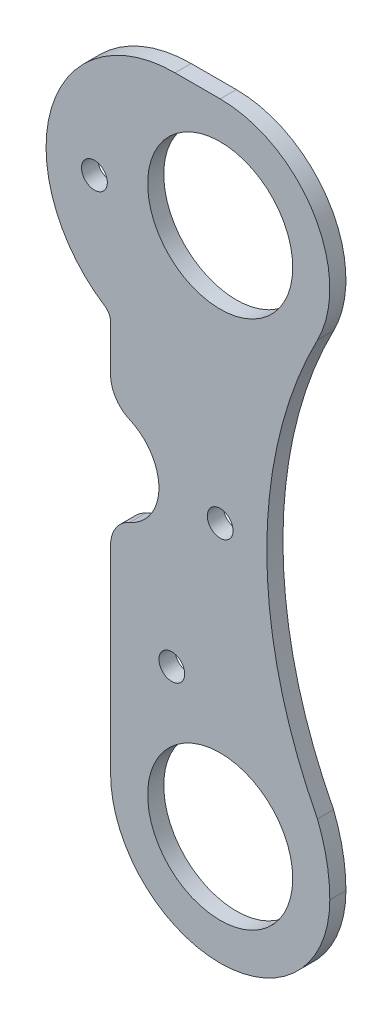
from build123d import *

# Parameters (mm, degrees)
SKETCH1_R            = 14.2875
SKETCH1_R_2          = 2.54
BOSS_EXTRUDE1_DEPTH  = 3.175
CUT_EXTRUDE1_DEPTH   = 162.674043733
FILLET3_R            = 6.35
BOSS_EXTRUDE3_START  = -3.175
SKETCH3_R            = 2.54
BOSS_EXTRUDE3_DEPTH  = 3.175
SKETCH6_R            = 2.54
BOSS_EXTRUDE4_DEPTH  = 3.175
FILLET2_R            = 6.35
CUT_EXTRUDE2_DEPTH   = 168.423732074
CUT_EXTRUDE3_DEPTH   = 168.423732074
CUT_EXTRUDE4_DEPTH   = 168.265702461
BOSS_EXTRUDE8_START  = -3.175
SKETCH15_R           = 2.54
BOSS_EXTRUDE8_DEPTH  = 3.175
FILLET4_R            = 2.54
BOSS_EXTRUDE9_DEPTH  = 3.175
SKETCH17_R           = 14.2875
BOSS_EXTRUDE10_DEPTH = 3.175
CUT_EXTRUDE5_DEPTH   = 131.456264953
SKETCH20_R           = 14.2875
CUT_EXTRUDE6_DEPTH   = 131.456264953
SKETCH21_R           = 2.54
CUT_EXTRUDE7_DEPTH   = 131.456264953


with BuildPart() as part:
    # Sketch1 → Boss-Extrude1 (new body)
    with BuildSketch(Plane.XY):
        with BuildLine():
            Line((-8.89, 25.4), (8.89, 25.4))
            ThreePointArc((8.89, 25.4), (17.870256121, 21.680256121), (21.59, 12.7))
            Line((21.59, 12.7), (21.59, -117.775079775))
            ThreePointArc((21.59, -117.775079775), (21.127743647, -120.388718212), (19.797058824, -122.685251408))
            Line((19.797058824, -122.685251408), (-7.952696208, -155.616779465))
            ThreePointArc((-7.952696208, -155.616779465), (-12.268297602, -157.851943494), (-16.900388255, -156.380852124))
            Line((-16.900388255, -156.380852124), (-32.439211784, -143.287061102))
            ThreePointArc((-32.439211784, -143.287061102), (-34.674375812, -138.971459708), (-33.203284443, -134.339369055))
            Line((-33.203284443, -134.339369055), (-23.382941176, -122.685251408))
            ThreePointArc((-23.382941176, -122.685251408), (-22.052256353, -120.388718212), (-21.59, -117.775079775))
            Line((-21.59, -117.775079775), (-21.59, 12.7))
            ThreePointArc((-21.59, 12.7), (-17.870256121, 21.680256121), (-8.89, 25.4))
        make_face()
        Circle(SKETCH1_R, mode=Mode.SUBTRACT)
        with Locations((0, -101.6)):
            Circle(SKETCH1_R, mode=Mode.SUBTRACT)
        with Locations((-18.532085478, -142.550133084)):
            Circle(SKETCH1_R_2, mode=Mode.SUBTRACT)
        with Locations((0, -50.8)):
            Circle(SKETCH1_R_2, mode=Mode.SUBTRACT)
    extrude(amount=BOSS_EXTRUDE1_DEPTH)

    # Sketch2 → Cut-Extrude1 (cut, through all)
    with BuildSketch(Plane.XY):
        with BuildLine():
            ThreePointArc((19.159083004, -91.647229609), (9.182340769, -50.8), (19.159083004, -9.952770391))
            ThreePointArc((19.159083004, -9.952770391), (20.973467787, -5.122670102), (21.59, 0))
            Line((21.59, 0), (27.94, 0))
            Line((27.94, 0), (27.94, -121.656687185))
            Line((27.94, -121.656687185), (-7.789552878, -164.05809836))
            Line((-7.789552878, -164.05809836), (-17.501317584, -155.874478972))
            Line((-17.501317584, -155.874478972), (16.51, -115.512152961))
            ThreePointArc((16.51, -115.512152961), (20.280273667, -109.005308906), (21.59, -101.6))
            ThreePointArc((21.59, -101.6), (20.973467787, -96.477329898), (19.159083004, -91.647229609))
        make_face()
        with BuildLine():
            Line((-21.59, -41.275), (-21.59, -60.325))
            ThreePointArc((-21.59, -60.325), (-12.065, -50.8), (-21.59, -41.275))
        make_face()
    extrude(amount=CUT_EXTRUDE1_DEPTH, mode=Mode.SUBTRACT)

    # Fillet3
    fillet3_edges = [part.edges().sort_by_distance(p)[0] for p in [
        (-21.59, -41.275, 1.5875),
        (-21.59, -60.325, 1.5875),
    ]]
    fillet(fillet3_edges, radius=FILLET3_R)

    # Sketch3 → Boss-Extrude3 (add)
    with BuildSketch(Plane.XY.offset(3.175).offset(BOSS_EXTRUDE3_START)):
        with BuildLine():
            Line((-27.351416194, -127.394768527), (-36.025496499, -137.688579))
            ThreePointArc((-36.025496499, -137.688579), (-37.217489152, -141.441859142), (-35.4063854, -144.93869507))
            Line((-35.4063854, -144.93869507), (-24.403104784, -154.210610454))
            ThreePointArc((-24.403104784, -154.210610454), (-19.771014132, -155.681701823), (-15.455412737, -153.446537795))
            Line((-15.455412737, -153.446537795), (-7.557639641, -144.073996091))
            Line((-7.557639641, -144.073996091), (-27.351416194, -127.394768527))
        make_face()
        with Locations((-18.532085478, -142.550133084)):
            Circle(SKETCH3_R, mode=Mode.SUBTRACT)
    extrude(amount=BOSS_EXTRUDE3_DEPTH)

    # Sketch6 → Boss-Extrude4 (add)
    with BuildSketch(Plane.XY.offset(3.175)):
        Polygon((-35.4063854, -144.93869507), (-63.620410749, -121.164144113), (-51.344981666, -106.596497054), (-27.065569901, -127.055545526), align=None)
        with Locations((-52.626813855, -117.972130278)):
            Circle(SKETCH6_R, mode=Mode.SUBTRACT)
    extrude(amount=-BOSS_EXTRUDE4_DEPTH)

    # Fillet2
    fillet2_edges = [part.edges().sort_by_distance(p)[0] for p in [
        (-63.620410749, -121.164144113, 1.5875),
        (-51.344981666, -106.596497054, 1.5875),
        (-27.065569901, -127.055545526, 1.5875),
    ]]
    fillet(fillet2_edges, radius=FILLET2_R)

    # Sketch7 → Cut-Extrude2 (cut, through all)
    with BuildSketch(Plane.XY.offset(3.175)):
        with BuildLine():
            Line((-21.59, 0), (-21.59, 31.75))
            Line((-21.59, 31.75), (21.59, 31.75))
            Line((21.59, 31.75), (21.59, 0))
            ThreePointArc((21.59, 0), (0, 21.59), (-21.59, 0))
        make_face()
    extrude(amount=-CUT_EXTRUDE2_DEPTH, mode=Mode.SUBTRACT)

    # Sketch10 → Cut-Extrude3 (cut, through all)
    with BuildSketch(Plane.XY.offset(3.175)):
        with BuildLine():
            Line((-18.151882461, -155.32628042), (-17.361482582, -157.512020269))
            Line((-17.361482582, -157.512020269), (-14.375706423, -156.432313955))
            Line((-14.375706423, -156.432313955), (-15.455412737, -153.446537795))
            ThreePointArc((-15.455412737, -153.446537795), (-16.679911193, -154.563907595), (-18.151882461, -155.32628042))
        make_face()
    extrude(amount=-CUT_EXTRUDE3_DEPTH, mode=Mode.SUBTRACT)

    # Sketch12 → Cut-Extrude4 (cut, through all)
    with BuildSketch(Plane.XY.offset(3.175)):
        with BuildLine():
            Line((-21.59, -101.6), (-72.39, -101.6))
            Line((-72.39, -101.6), (-72.39, -165.1))
            Line((-72.39, -165.1), (16.51, -165.1))
            Line((16.51, -165.1), (16.51, -115.512152961))
            ThreePointArc((16.51, -115.512152961), (-7.405308906, -121.880273667), (-21.59, -101.6))
        make_face()
    extrude(amount=-CUT_EXTRUDE4_DEPTH, mode=Mode.SUBTRACT)

    # Sketch15 → Boss-Extrude8 (add)
    with BuildSketch(Plane.XY.offset(3.175).offset(BOSS_EXTRUDE8_START)):
        with BuildLine():
            ThreePointArc((-34.29, -3.81), (-30.887045256, -16.51), (-21.59, -25.807045256))
            Line((-21.59, -25.807045256), (-21.59, 0))
            ThreePointArc((-21.59, 0), (-15.266435406, 15.266435406), (0, 21.59))
            Line((0, 21.59), (-8.89, 21.59))
            ThreePointArc((-8.89, 21.59), (-26.850512242, 14.150512242), (-34.29, -3.81))
        make_face()
        with Locations((-24.765, -3.81)):
            Circle(SKETCH15_R, mode=Mode.SUBTRACT)
    extrude(amount=BOSS_EXTRUDE8_DEPTH)

    # Fillet4
    fillet4_edges = [part.edges().sort_by_distance(p)[0] for p in [
        (-21.59, -25.807045256, 1.5875),
    ]]
    fillet(fillet4_edges, radius=FILLET4_R)

    # Sketch16 → Boss-Extrude9 (add, through all)
    with BuildSketch(Plane.XY.offset(3.175)):
        with BuildLine():
            Line((-21.59, -101.6), (-1.489522905, -121.700477095))
            Line((-1.489522905, -121.700477095), (4.517920132, -121.700477095))
            Line((4.517920132, -121.700477095), (21.59, -101.6))
            Line((21.59, -101.6), (21.59, -104.23906))
            ThreePointArc((21.59, -104.23906), (0, -125.82906), (-21.59, -104.23906))
            Line((-21.59, -104.23906), (-21.59, -101.6))
        make_face()
    extrude(amount=-BOSS_EXTRUDE9_DEPTH)

    # Sketch17 → Boss-Extrude10 (add, through all)
    with BuildSketch(Plane.XY.offset(3.175)):
        with Locations((0, -101.6)):
            Circle(SKETCH17_R)
    extrude(amount=-BOSS_EXTRUDE10_DEPTH)

    # Sketch19 → Cut-Extrude5 (cut, through all)
    with BuildSketch(Plane.XY.offset(3.175)):
        with BuildLine():
            Line((19.159083004, -91.647229609), (21.59, -91.647229609))
            Line((21.59, -91.647229609), (21.59, -104.23906))
            ThreePointArc((21.59, -104.23906), (20.97671132, -97.826892854), (19.159083004, -91.647229609))
        make_face()
    extrude(amount=-CUT_EXTRUDE5_DEPTH, mode=Mode.SUBTRACT)

    # Sketch20 → Cut-Extrude6 (cut, through all)
    with BuildSketch(Plane.XY.offset(3.175)):
        with Locations((0, -104.23906)):
            Circle(SKETCH20_R)
    extrude(amount=-CUT_EXTRUDE6_DEPTH, mode=Mode.SUBTRACT)

    # Sketch21 → Cut-Extrude7 (cut, through all)
    with BuildSketch(Plane.XY.offset(3.175)):
        with Locations((-9.525, -80.01)):
            Circle(SKETCH21_R)
    extrude(amount=-CUT_EXTRUDE7_DEPTH, mode=Mode.SUBTRACT)


solid = part.part
